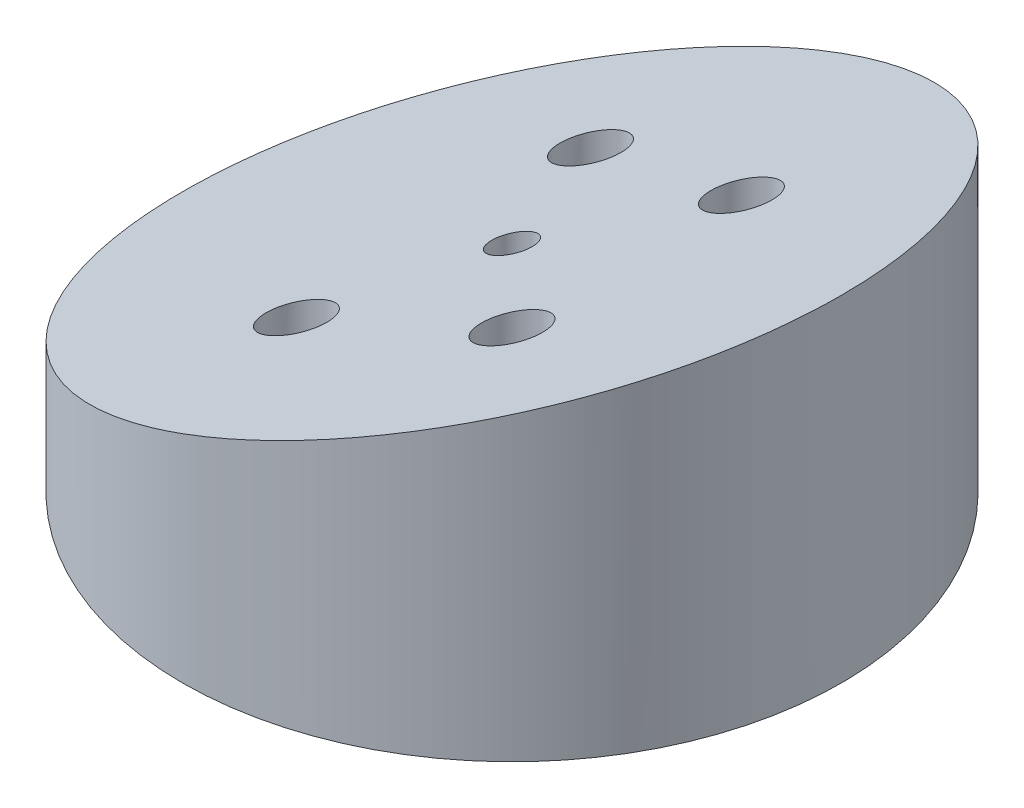
from build123d import *

# Parameters (mm, degrees)
CUT_EXTRUDE1_DEPTH      = 874.621652083
CUT_EXTRUDE1_DEPTH_BACK = 874.621652083
SKETCH6_R               = 38.1
SKETCH9_W               = 1605.930086896
SKETCH9_H               = 1331.723127606
CUT_EXTRUDE8_DEPTH      = 762.168569892


with BuildPart() as part:
    # Sketch4 → Revolve3 (revolve)
    with BuildSketch(Plane.XY):
        with BuildLine():
            Line((25.4, 650.00817936), (25.4, 83.643188795))
            ThreePointArc((25.4, 83.643188795), (205.276173143, 67.197534451), (381, 25.4))
            Line((381, 25.4), (412.7373, 25.4))
            Line((412.7373, 25.4), (412.7373, 488.95))
            Line((412.7373, 488.95), (411.1498, 488.95))
            Line((411.1498, 488.95), (411.1498, 514.35))
            ThreePointArc((411.1498, 514.35), (404.683813004, 537.626492136), (387.141395745, 554.23575674))
            ThreePointArc((387.141395745, 554.23575674), (211.762891066, 622.866495309), (25.4, 650.00817936))
        make_face()
    revolve(axis=Axis((0, 588.703209944, 0), (0, -1, 0)))

    # Sketch6 → Cut-Extrude1 (cut, two sides: drawn at the far end of the back side and taken through both)
    with BuildSketch(Plane(origin=(0, 0, 0), x_dir=(1, 0, 0), z_dir=(0, 1, 0)).offset(-CUT_EXTRUDE1_DEPTH_BACK)):
        with Locations((143.684097937, 143.684097937)):
            Circle(SKETCH6_R)
        with Locations((-85.876030786, 184.161742326)):
            Circle(SKETCH6_R)
        with Locations((-85.876030786, -184.161742326)):
            Circle(SKETCH6_R)
        with Locations((143.684097937, -143.684097937)):
            Circle(SKETCH6_R)
    extrude(amount=CUT_EXTRUDE1_DEPTH + CUT_EXTRUDE1_DEPTH_BACK, mode=Mode.SUBTRACT)

    # Sketch9 → Cut-Extrude8 (cut, through all)
    with BuildSketch(Plane(origin=(-95.081116315, 261.233220092, 0), x_dir=(-0.9396926207859104, -0.34202014332566316, 0), z_dir=(0.34202014332566316, -0.9396926207859104, 0))):
        Rectangle(SKETCH9_W, SKETCH9_H)
    extrude(amount=-CUT_EXTRUDE8_DEPTH, mode=Mode.SUBTRACT)


solid = part.part
